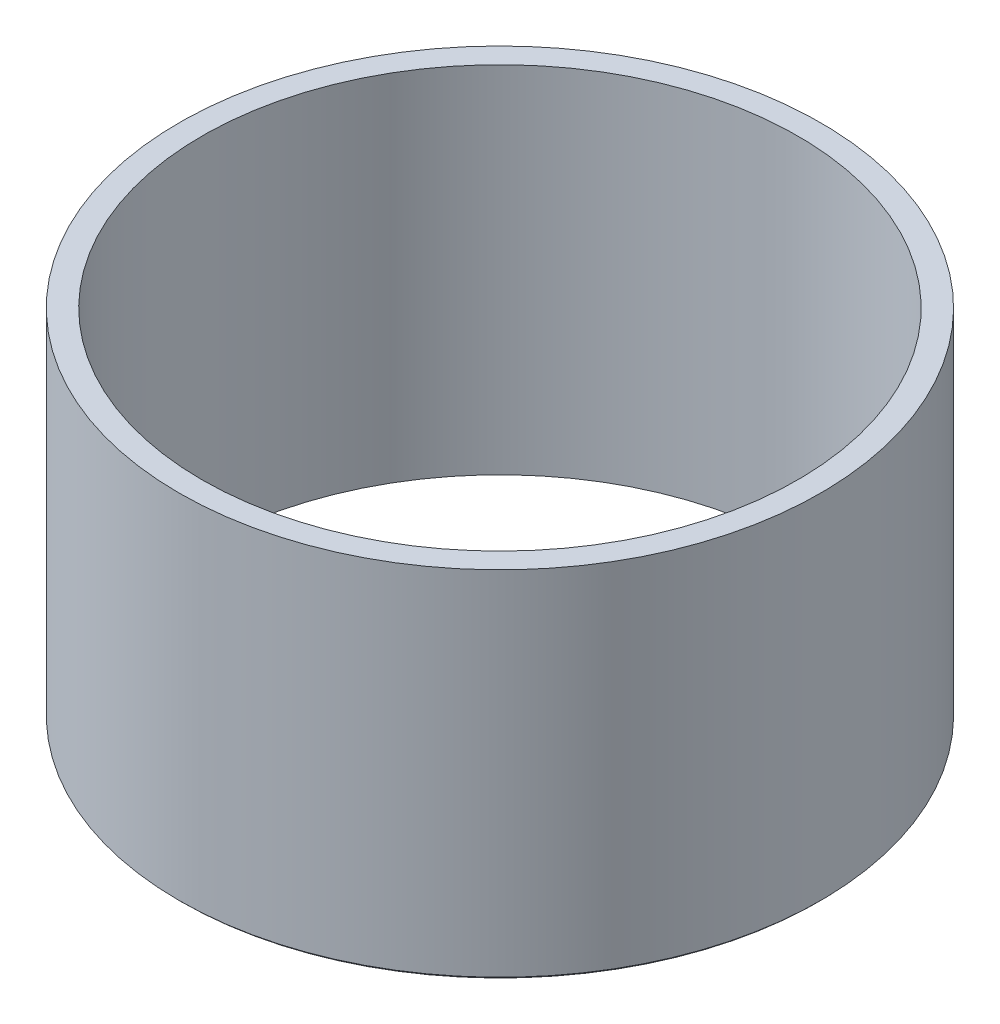
from build123d import *

# Parameters (mm, degrees)
CROQUIS1_R              = 14
CROQUIS1_R_2            = 13
SALIENTE_EXTRUIR1_DEPTH = 15.5
CHAFL_N1_SIZE           = 0.1


with BuildPart() as part:
    # Croquis1 → Saliente-Extruir1 (new body)
    with BuildSketch(Plane(origin=(0, 0, 0), x_dir=(1, 0, 0), z_dir=(0, 1, 0))):
        with Locations(Location((0, 0, 0), (0, 0, 270))):
            Circle(CROQUIS1_R)
        with Locations(Location((0, 0, 0), (0, 0, 270))):
            Circle(CROQUIS1_R_2, mode=Mode.SUBTRACT)
    extrude(amount=SALIENTE_EXTRUIR1_DEPTH)

    # Chaflán1
    chafl_n1_edges = [part.edges().sort_by_distance(p)[0] for p in [
        (0, 0, -14),
    ]]
    chamfer(chafl_n1_edges, length=CHAFL_N1_SIZE)


solid = part.part
